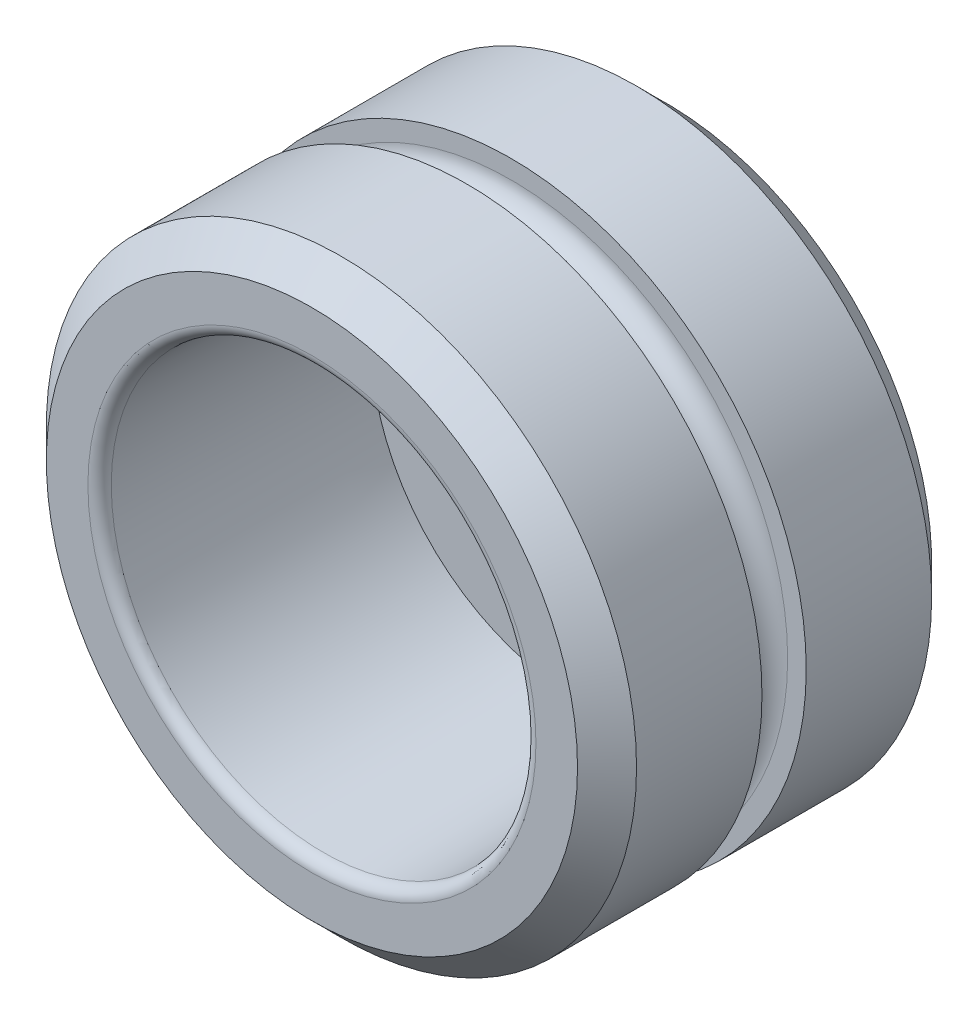
from build123d import *

# Parameters (mm, degrees)
CHAMFER_1_SIZE = 1
FILLET_1_R     = 0.4


with BuildPart() as part:
    # 스케치1 → 회전1 (revolve)
    with BuildSketch(Plane(origin=(0, 0, 0), x_dir=(1, 0, 0), z_dir=(0, 1, 0))):
        with BuildLine():
            Line((0, 0), (4, 0))
            Line((4, 0), (5.894700279, 0.5))
            Line((5.894700279, 0.5), (10, 0.5))
            Line((10, 0.5), (10, -4.75))
            Line((10, -4.75), (9.37, -4.75))
            ThreePointArc((9.37, -4.75), (8.62, -5.5), (9.37, -6.25))
            Line((9.37, -6.25), (10, -6.25))
            Line((10, -6.25), (10, -11.5))
            Line((10, -11.5), (7.2, -11.5))
            Line((7.2, -11.5), (7, -2.5))
            Line((7, -2.5), (0, -2.5))
            Line((0, -2.5), (0, 0))
        make_face()
    revolve(axis=Axis((0, 0, 2.5), (0, 0, -1)))

    # 모따기1
    chamfer_1_edges = [part.edges().sort_by_distance(p)[0] for p in [
        (-10, 0, 11.5),
        (-10, 0, -0.5),
    ]]
    chamfer(chamfer_1_edges, length=CHAMFER_1_SIZE)

    # 필렛1
    fillet_1_edges = [part.edges().sort_by_distance(p)[0] for p in [
        (-7.2, 0, 11.5),
        (-5.894700279, 0, -0.5),
    ]]
    fillet(fillet_1_edges, radius=FILLET_1_R)


solid = part.part
